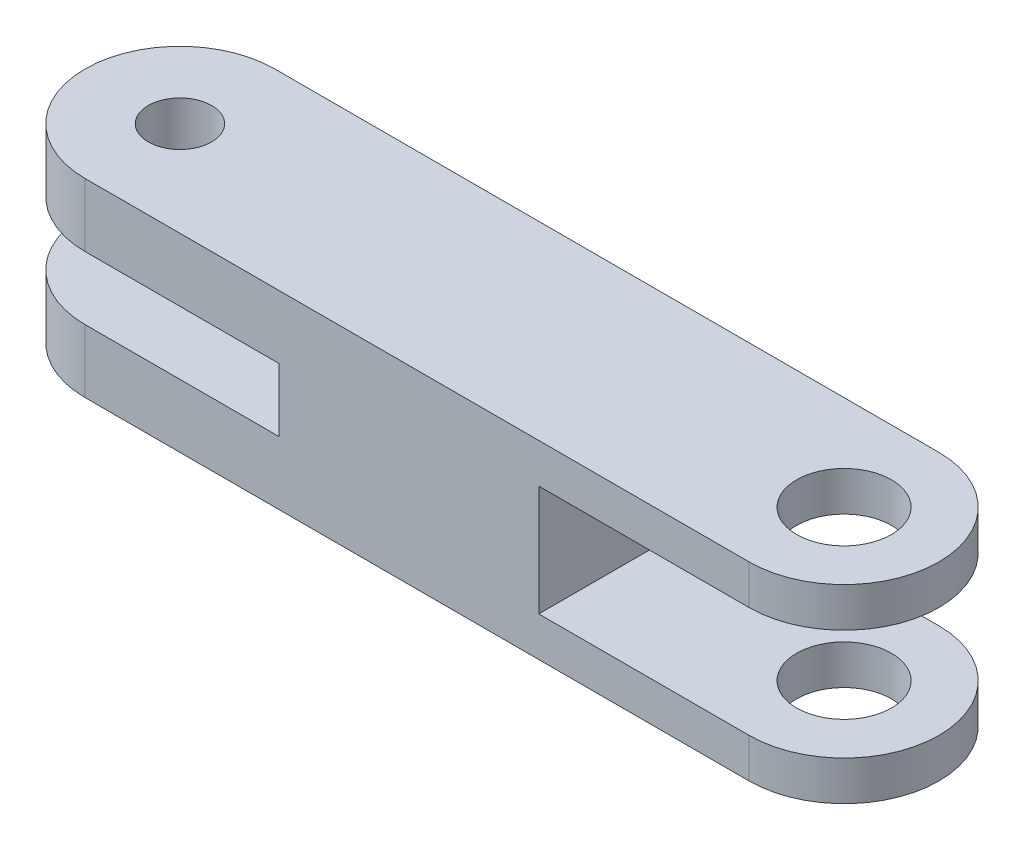
from build123d import *

# Parameters (mm, degrees)
SKETCH_1_R          = 1.5
SKETCH_1_R_2        = 1
EXTRUDE_1_DEPTH     = 3
SKETCH_6_W          = 31.511370345
SKETCH_6_H          = 11.605197544
CUT_EXTRUDE_2_DEPTH = 1.75
SKETCH_7_W          = 12.660216836
SKETCH_7_H          = 9.649927943
CUT_EXTRUDE_3_DEPTH = 1


with BuildPart() as part:
    # 草图1 → 凸台-拉伸1 (new, symmetric)
    with BuildSketch(Plane(origin=(0, 0, 0), x_dir=(1, 0, 0), z_dir=(0, 1, 0))):
        with BuildLine():
            Line((0, 3), (21, 3))
            ThreePointArc((21, 3), (24, 0), (21, -3))
            Line((21, -3), (0, -3))
            ThreePointArc((0, -3), (-3, 0), (0, 3))
        make_face()
        with Locations(Location((21, 0, 0), (0, 0, 270))):
            Circle(SKETCH_1_R, mode=Mode.SUBTRACT)
        with Locations(Location((0, 0, 0), (0, 0, 270))):
            Circle(SKETCH_1_R_2, mode=Mode.SUBTRACT)
    extrude(amount=EXTRUDE_1_DEPTH, both=True)

    # 草图6 → 切除-拉伸2 (cut, symmetric)
    with BuildSketch(Plane(origin=(0, 0, 0), x_dir=(1, 0, 0), z_dir=(0, 1, 0))):
        with Locations((30.101826092, 2.040608699)):
            Rectangle(SKETCH_6_W, SKETCH_6_H)
    extrude(amount=CUT_EXTRUDE_2_DEPTH, both=True, mode=Mode.SUBTRACT)

    # 草图7 → 切除-拉伸3 (cut, symmetric)
    with BuildSketch(Plane(origin=(0, 0, 0), x_dir=(1, 0, 0), z_dir=(0, 1, 0))):
        with Locations((-0.191074288, 0.210879474)):
            Rectangle(SKETCH_7_W, SKETCH_7_H)
    extrude(amount=CUT_EXTRUDE_3_DEPTH, both=True, mode=Mode.SUBTRACT)


solid = part.part
